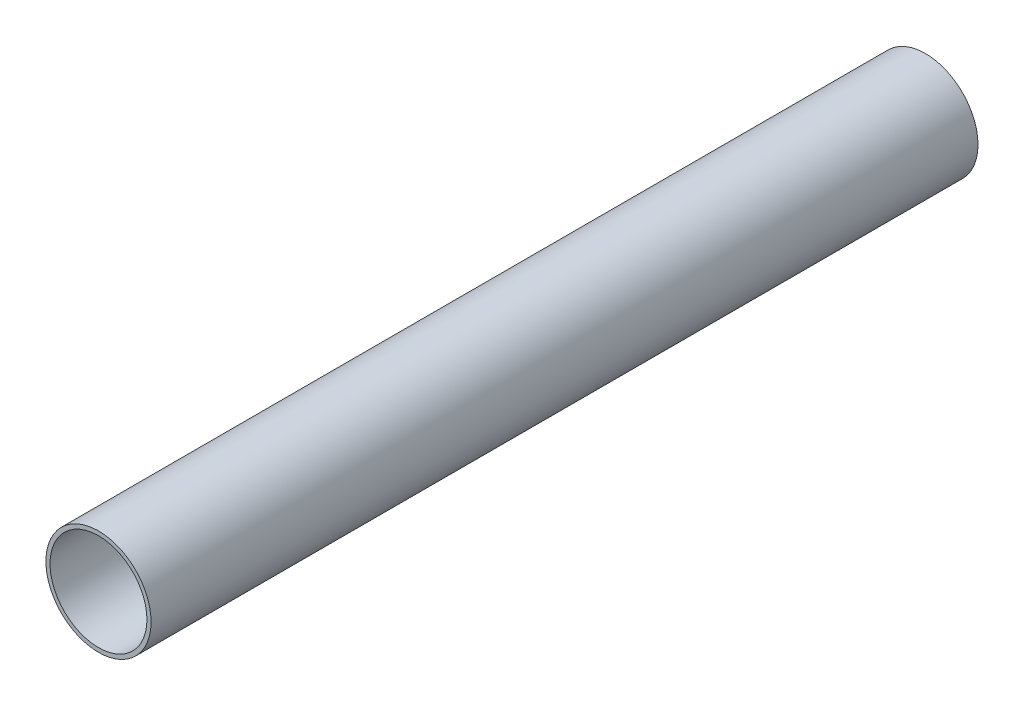
from build123d import *

# Parameters (mm, degrees)
SKETCH1_R           = 15.9
BOSS_EXTRUDE1_DEPTH = 250
CUT_EXTRUDE1_REACH  = 253.009
SKETCH2_R           = 14.65


with BuildPart() as part:
    # Sketch1 → Boss-Extrude1 (new body)
    with BuildSketch(Plane.XY):
        Circle(SKETCH1_R)
    extrude(amount=-BOSS_EXTRUDE1_DEPTH)

    # Sketch2 → Cut-Extrude1 (cut, up to next)
    with BuildSketch(Plane.XY, mode=Mode.PRIVATE) as cut_extrude1_sk1:
        Circle(SKETCH2_R)
    cut_extrude1_tool1 = extrude(cut_extrude1_sk1.sketch, amount=-CUT_EXTRUDE1_REACH, mode=Mode.PRIVATE) & part.part
    add(cut_extrude1_tool1.solids().sort_by_distance((0, 0, 0))[0], mode=Mode.SUBTRACT)


solid = part.part
